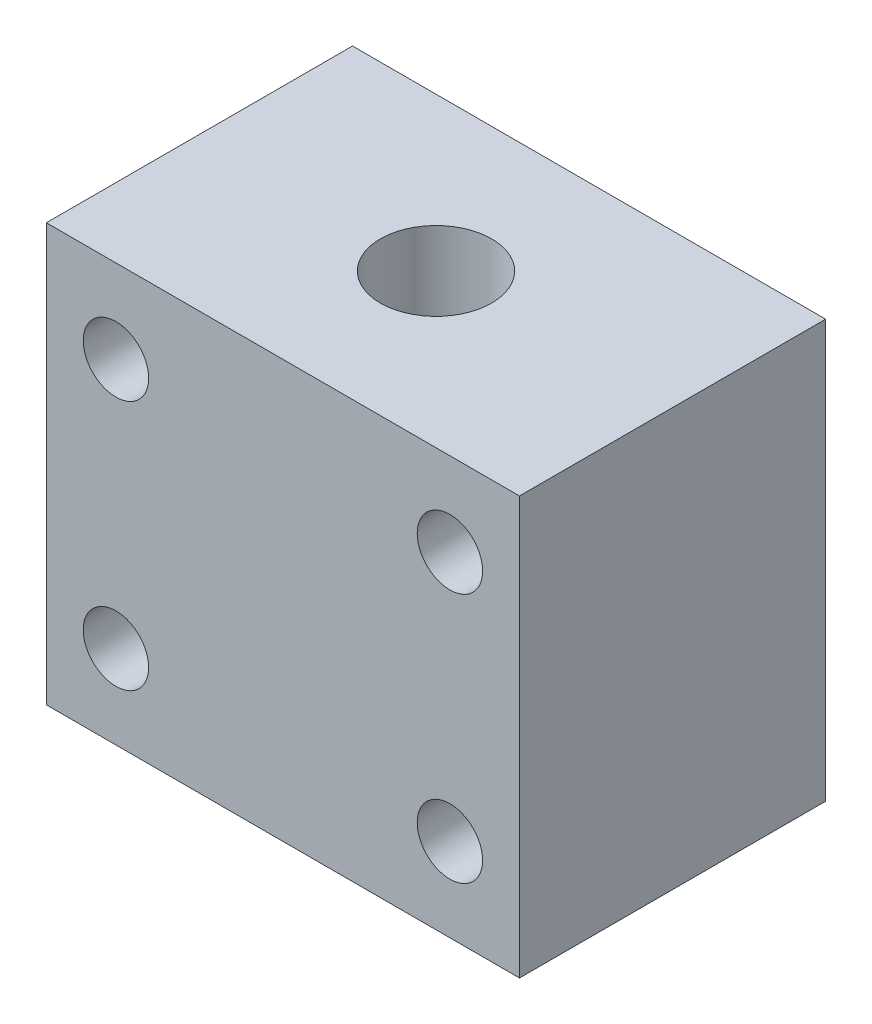
from build123d import *

# Parameters (mm, degrees)
SKETCH1_W           = 34
SKETCH1_H           = 22
SKETCH1_R           = 4
BOSS_EXTRUDE1_DEPTH = 30
SKETCH3_R           = 2.35
CUT_EXTRUDE1_DEPTH  = 5


with BuildPart() as part:
    # Sketch1 → Boss-Extrude1 (new body)
    with BuildSketch(Plane(origin=(0, 0, 0), x_dir=(1, 0, 0), z_dir=(0, 1, 0))):
        Rectangle(SKETCH1_W, SKETCH1_H)
        with Locations(Location((0, 0, 0), (0, 0, 270))):
            Circle(SKETCH1_R, mode=Mode.SUBTRACT)
    extrude(amount=BOSS_EXTRUDE1_DEPTH)

    # Sketch3 → Cut-Extrude1 (cut)
    with BuildSketch(Plane.XY.offset(11)):
        with Locations((-12, 24)):
            Circle(SKETCH3_R)
        with Locations((-12, 6)):
            Circle(SKETCH3_R)
        with Locations(Location((12, 6, 0), (0, 0, 180))):
            Circle(SKETCH3_R)
        with Locations(Location((12, 24, 0), (0, 0, 180))):
            Circle(SKETCH3_R)
    extrude(amount=-CUT_EXTRUDE1_DEPTH, mode=Mode.SUBTRACT)


solid = part.part
